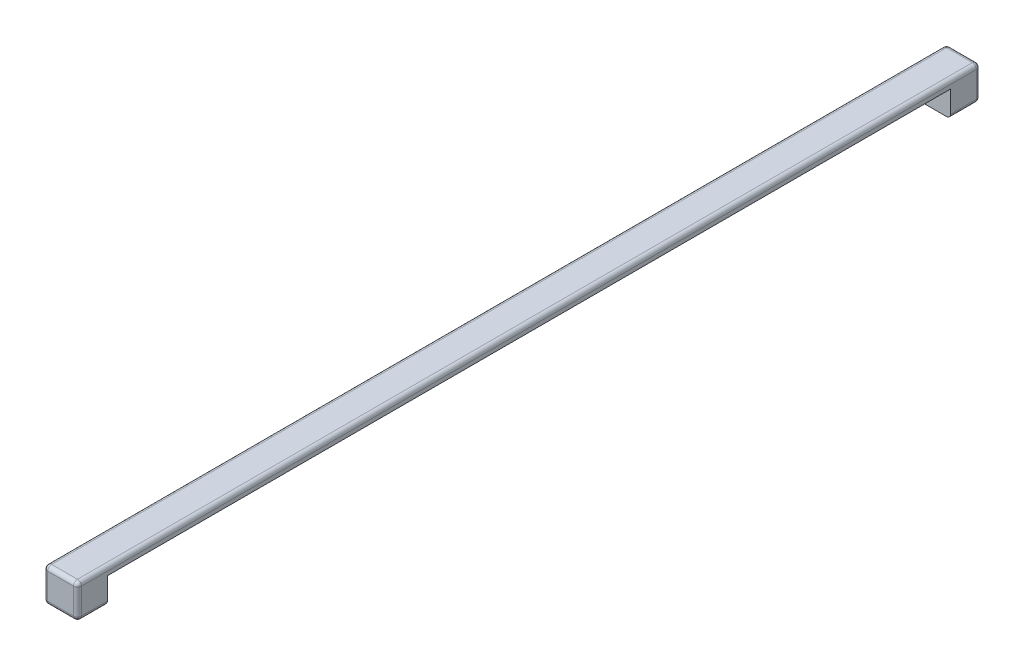
from build123d import *

# Parameters (mm, degrees)
SKETCH1_W               = 8.5
SKETCH1_H               = 8.5
BOSS_EXTRUDE1_DEPTH     = 113.5
FILLET2_R               = 1
CUT_EXTRUDE1_DEPTH      = 106
CUT_EXTRUDE1_DEPTH_BACK = 106
SKETCH2_W               = 6.5
SKETCH2_H               = 6.5


with BuildPart() as part:
    # Sketch1 → Boss-Extrude1 (new, symmetric)
    with BuildSketch(Plane.XY):
        Rectangle(SKETCH1_W, SKETCH1_H)
    extrude(amount=BOSS_EXTRUDE1_DEPTH, both=True)

    # Fillet2
    fillet2_edges = [part.edges().sort_by_distance(p)[0] for p in [
        (-4.25, 0, 113.5),
        (0, -4.25, 113.5),
        (4.25, 0, 113.5),
        (0, -4.25, -113.5),
        (-4.25, 0, -113.5),
        (0, 4.25, -113.5),
        (4.25, 0, -113.5),
        (4.25, -4.25, 0),
        (-4.25, -4.25, 0),
        (-4.25, 4.25, 0),
        (4.25, 4.25, 0),
        (0, 4.25, 113.5),
    ]]
    fillet(fillet2_edges, radius=FILLET2_R)

    # Sketch2 → Cut-Extrude1 (cut, two sides: drawn at the far end of the back side and taken through both)
    with BuildSketch(Plane.XY.offset(-CUT_EXTRUDE1_DEPTH_BACK)):
        with Locations((1, -1)):
            Rectangle(SKETCH2_W, SKETCH2_H)
    extrude(amount=CUT_EXTRUDE1_DEPTH + CUT_EXTRUDE1_DEPTH_BACK, mode=Mode.SUBTRACT)


solid = part.part
